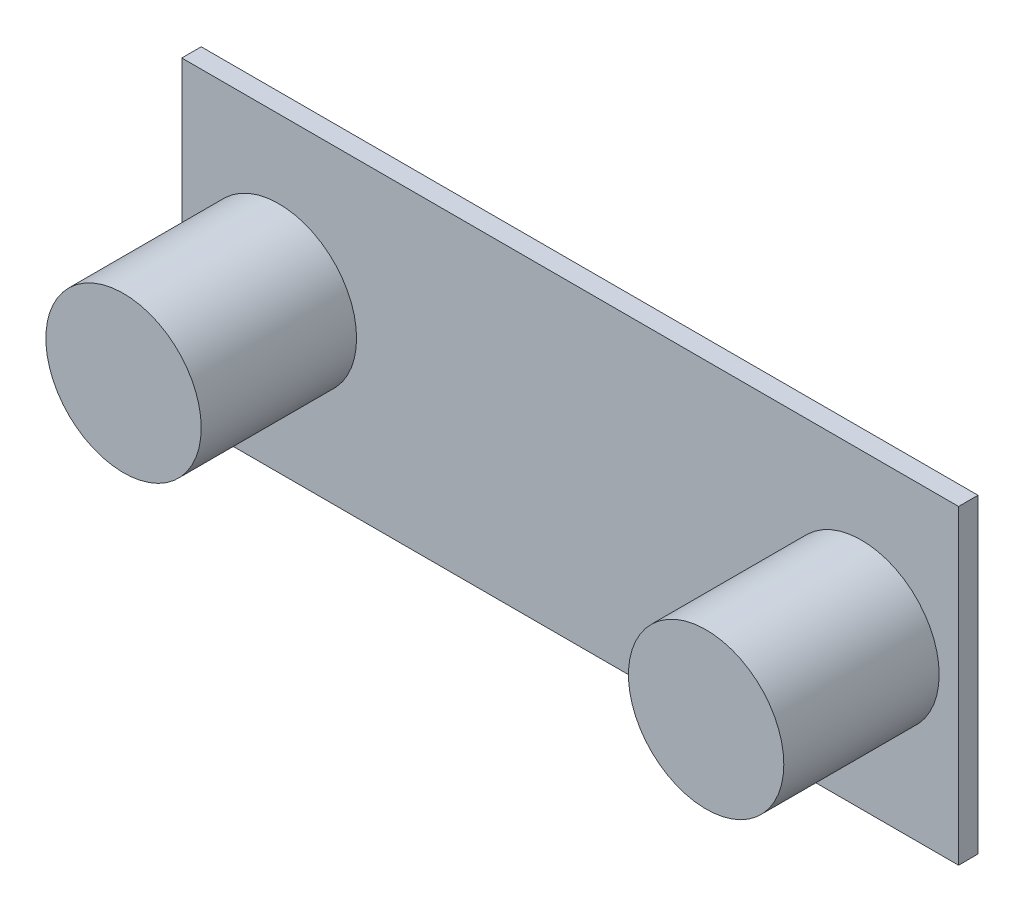
from build123d import *

# Parameters (mm, degrees)
SKETCH1_W           = 80
SKETCH1_H           = 32
BOSS_EXTRUDE1_DEPTH = 2
SKETCH3_R           = 8
BOSS_EXTRUDE2_DEPTH = 16


with BuildPart() as part:
    # Sketch1 → Boss-Extrude1 (new body)
    with BuildSketch(Plane.XY):
        Rectangle(SKETCH1_W, SKETCH1_H)
    extrude(amount=BOSS_EXTRUDE1_DEPTH)

    # Sketch3 → Boss-Extrude2 (add)
    with BuildSketch(Plane.XY.offset(2)):
        with Locations((-30, 0)):
            Circle(SKETCH3_R)
        with Locations((30, 0)):
            Circle(SKETCH3_R)
    extrude(amount=BOSS_EXTRUDE2_DEPTH)


solid = part.part
